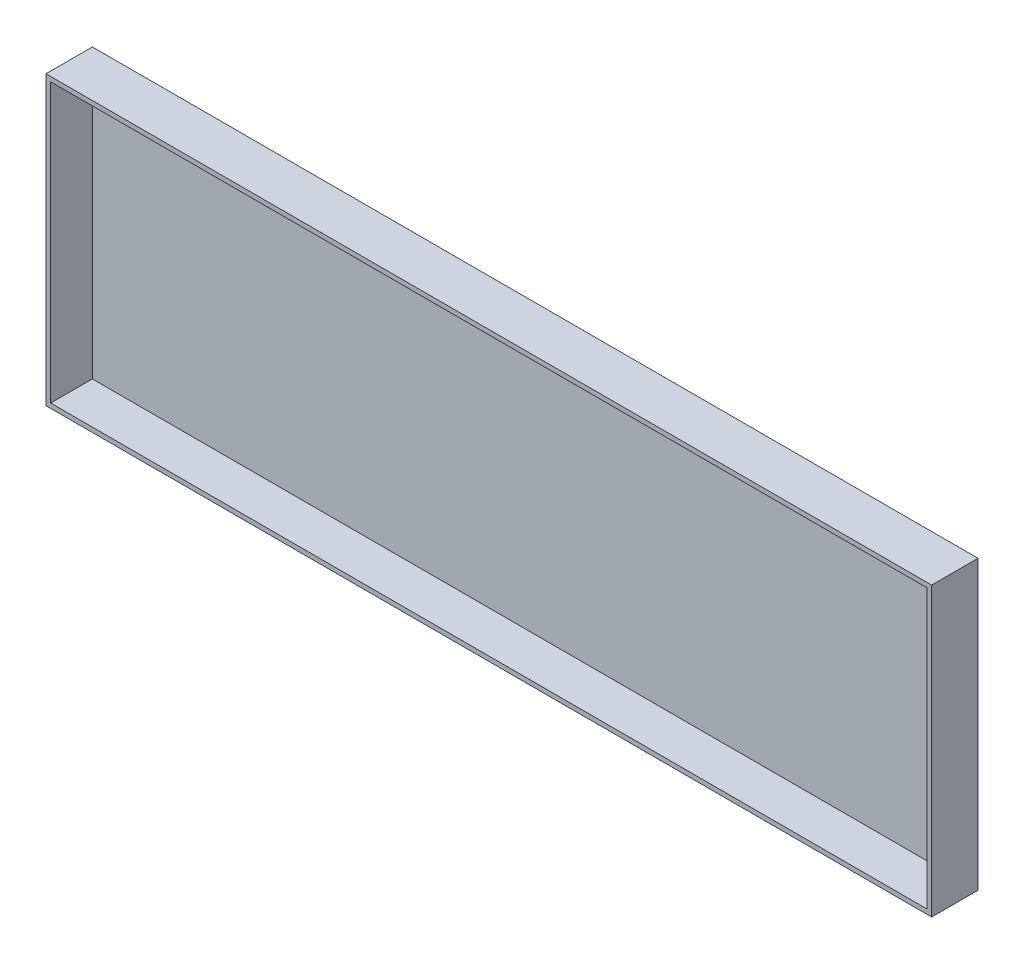
from build123d import *

# Parameters (mm, degrees)
SKETCH1_W           = 955
SKETCH1_H           = 310
BOSS_EXTRUDE1_DEPTH = 5
BOSS_EXTRUDE2_START = 5
SKETCH2_W           = 955
SKETCH2_H           = 310
SKETCH2_W_2         = 945
SKETCH2_H_2         = 300
BOSS_EXTRUDE2_DEPTH = 45


with BuildPart() as part:
    # Sketch1 → Boss-Extrude1 (new body)
    with BuildSketch(Plane.XY):
        Rectangle(SKETCH1_W, SKETCH1_H)
    extrude(amount=BOSS_EXTRUDE1_DEPTH)

    # Sketch2 → Boss-Extrude2 (add)
    with BuildSketch(Plane.XY.offset(BOSS_EXTRUDE2_START)):
        Rectangle(SKETCH2_W, SKETCH2_H)
        Rectangle(SKETCH2_W_2, SKETCH2_H_2, mode=Mode.SUBTRACT)
    extrude(amount=BOSS_EXTRUDE2_DEPTH)


solid = part.part
